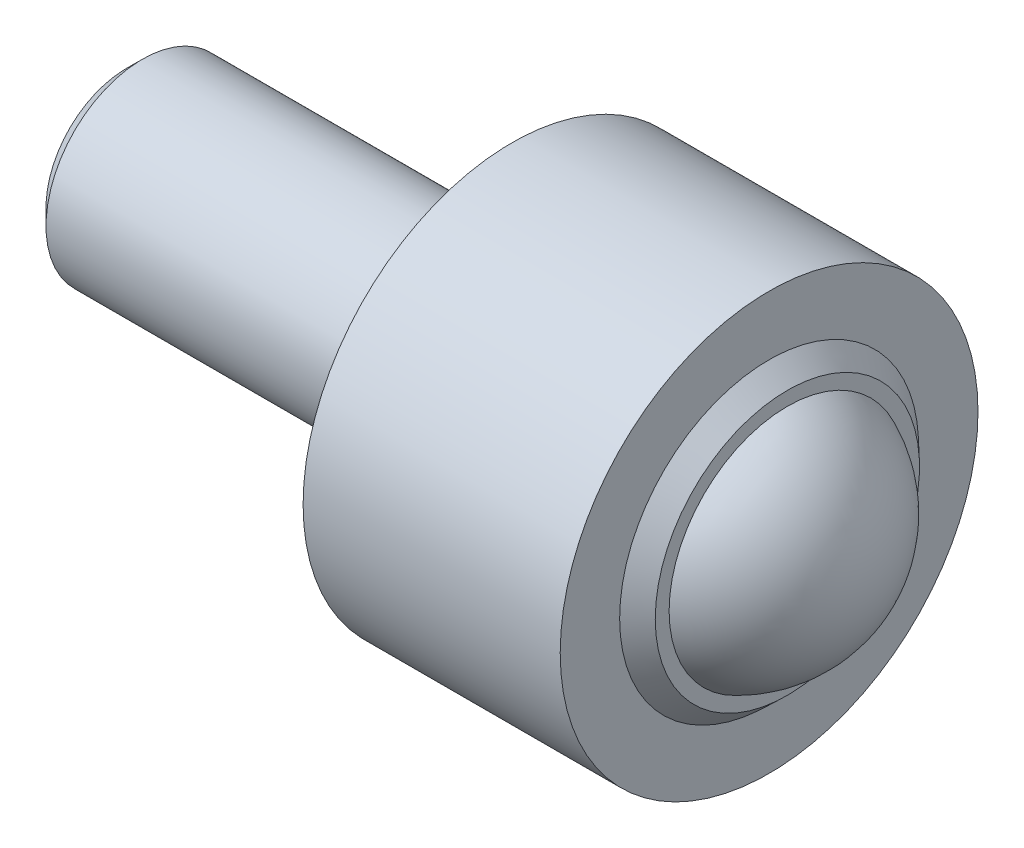
from build123d import *

# Parameters (mm, degrees)
SKETCH_1_R      = 3
EXTRUDE_1_DEPTH = 12
SKETCH_2_R      = 6.5
EXTRUDE_2_DEPTH = 8
CHAMFER_1_SIZE  = 0.5


with BuildPart() as part:
    # 草图1 → 凸台-拉伸1 (new body)
    with BuildSketch(Plane(origin=(0, 0, 0), x_dir=(0, 0, -1), z_dir=(1, 0, 0))):
        Circle(SKETCH_1_R)
    extrude(amount=EXTRUDE_1_DEPTH)

    # 草图2 → 凸台-拉伸2 (add)
    with BuildSketch(Plane(origin=(12, 0, 0), x_dir=(0, 0, -1), z_dir=(1, 0, 0))):
        Circle(SKETCH_2_R)
    extrude(amount=EXTRUDE_2_DEPTH)

    # 草图3 → 旋转2 (revolve)
    with BuildSketch(Plane(origin=(0, 0, 0), x_dir=(1, 0, 0), z_dir=(0, 1, 0)), mode=Mode.PRIVATE) as revolve_2_sk:
        with BuildLine():
            Line((15, 0), (23, 0))
            ThreePointArc((23, 0), (22.337104701, 2.20538709), (20.568133892, 3.679803812))
            Line((20.568133892, 3.679803812), (20.568133892, 4.110994158))
            Line((20.568133892, 4.110994158), (20, 4.650865374))
            Line((20, 4.650865374), (20, 3.872983346))
            ThreePointArc((20, 3.872983346), (16.550510257, 3.16227766), (15, 0))
        make_face()
    revolve(revolve_2_sk.sketch.rotate(Axis((15, 0, 0), (1, 0, 0)), 180), axis=Axis((15, 0, 0), (1, 0, 0)))

    # 倒角1
    chamfer_1_edges = [part.edges().sort_by_distance(p)[0] for p in [
        (0, 0, 3),
    ]]
    chamfer(chamfer_1_edges, length=CHAMFER_1_SIZE)


solid = part.part
